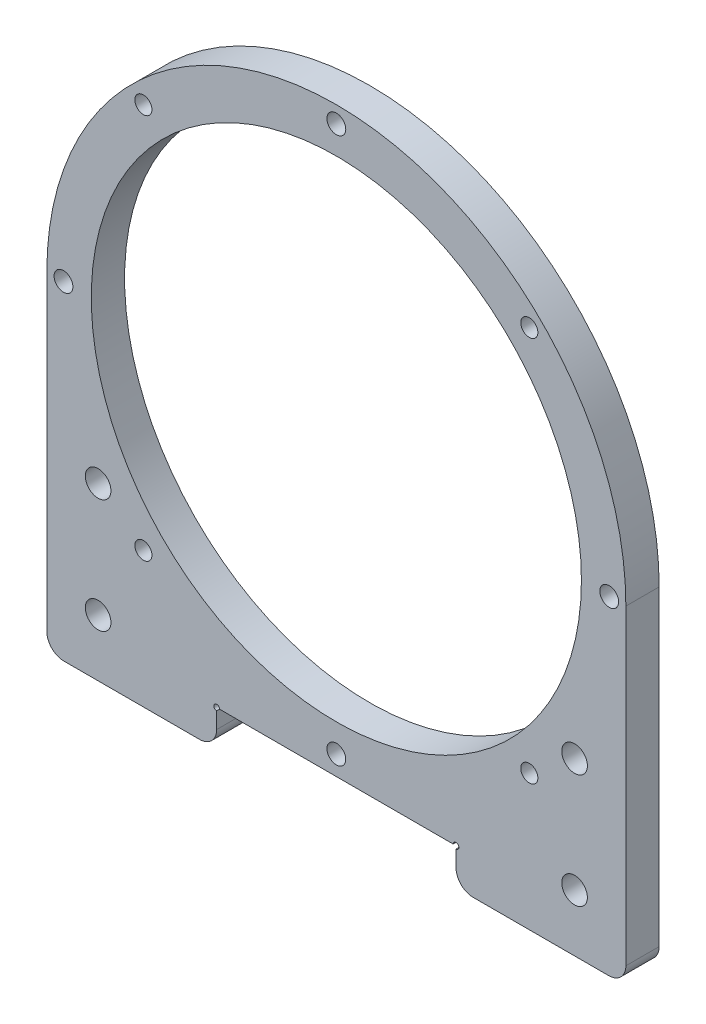
from build123d import *

# Parameters (mm, degrees)
SKETCH1_R           = 2.25
SKETCH1_R_2         = 44.958
SKETCH1_R_3         = 1.65
SKETCH1_R_4         = 1.5
BOSS_EXTRUDE1_DEPTH = 5.842
SKETCH2_R           = 44.958
SKETCH2_R_2         = 43
BOSS_EXTRUDE2_DEPTH = 5.842
SKETCH3_W           = 42
SKETCH3_H           = 6.35
CUT_EXTRUDE1_DEPTH  = 78.066295668
SKETCH4_R           = 0.5
CUT_EXTRUDE2_DEPTH  = 78.066295668
FILLET1_R           = 3


with BuildPart() as part:
    # Sketch1 → Boss-Extrude1 (new body)
    with BuildSketch(Plane.XY):
        with BuildLine():
            Line((-50.8, 0), (-50.8, -57.658))
            Line((-50.8, -57.658), (50.8, -57.658))
            Line((50.8, -57.658), (50.8, 0))
            ThreePointArc((50.8, 0), (0, 50.8), (-50.8, 0))
        make_face()
        with Locations((41.8, -47.658)):
            Circle(SKETCH1_R, mode=Mode.SUBTRACT)
        Circle(SKETCH1_R_2, mode=Mode.SUBTRACT)
        with Locations((-47.879, 0)):
            Circle(SKETCH1_R_3, mode=Mode.SUBTRACT)
        with Locations((0, 47.879)):
            Circle(SKETCH1_R_3, mode=Mode.SUBTRACT)
        with Locations((41.8, -27.658)):
            Circle(SKETCH1_R, mode=Mode.SUBTRACT)
        with Locations((47.879, 0)):
            Circle(SKETCH1_R_3, mode=Mode.SUBTRACT)
        with Locations((0, -47.879)):
            Circle(SKETCH1_R_3, mode=Mode.SUBTRACT)
        with Locations((-33.855565576, 33.855565576)):
            Circle(SKETCH1_R_4, mode=Mode.SUBTRACT)
        with Locations((33.855565576, 33.855565576)):
            Circle(SKETCH1_R_4, mode=Mode.SUBTRACT)
        with Locations((33.855565576, -33.855565576)):
            Circle(SKETCH1_R_4, mode=Mode.SUBTRACT)
        with Locations((-33.855565576, -33.855565576)):
            Circle(SKETCH1_R_4, mode=Mode.SUBTRACT)
        with Locations((-41.8, -27.658)):
            Circle(SKETCH1_R, mode=Mode.SUBTRACT)
        with Locations((-41.8, -47.658)):
            Circle(SKETCH1_R, mode=Mode.SUBTRACT)
    extrude(amount=BOSS_EXTRUDE1_DEPTH)

    # Sketch2 → Boss-Extrude2 (add, through all)
    with BuildSketch(Plane.XY.offset(5.842)):
        Circle(SKETCH2_R)
        Circle(SKETCH2_R_2, mode=Mode.SUBTRACT)
    extrude(amount=-BOSS_EXTRUDE2_DEPTH)

    # Sketch3 → Cut-Extrude1 (cut, through all)
    with BuildSketch(Plane.XY.offset(5.842)):
        with Locations((0, -54.483)):
            Rectangle(SKETCH3_W, SKETCH3_H)
    extrude(amount=-CUT_EXTRUDE1_DEPTH, mode=Mode.SUBTRACT)

    # Sketch4 → Cut-Extrude2 (cut, through all)
    with BuildSketch(Plane.XY.offset(5.842)):
        with Locations((-21, -51.308)):
            Circle(SKETCH4_R)
        with Locations((21, -51.308)):
            Circle(SKETCH4_R)
    extrude(amount=-CUT_EXTRUDE2_DEPTH, mode=Mode.SUBTRACT)

    # Fillet1
    fillet1_edges = [part.edges().sort_by_distance(p)[0] for p in [
        (50.8, -57.658, 2.921),
        (-50.8, -57.658, 2.921),
        (-21, -57.658, 2.921),
        (21, -57.658, 2.921),
    ]]
    fillet(fillet1_edges, radius=FILLET1_R)


solid = part.part
